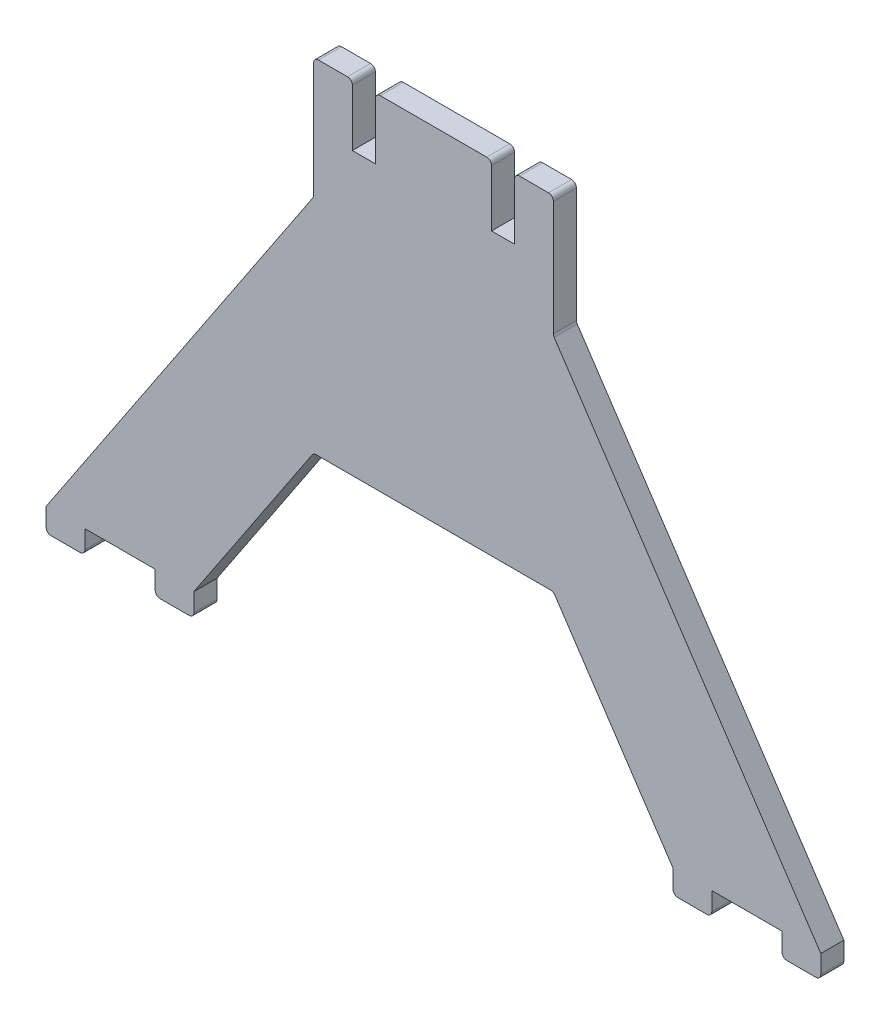
from build123d import *

# Parameters (mm, degrees)
BOSS_EXTRUDE1_DEPTH = 4.7625


with BuildPart() as part:
    # Sketch2 → Boss-Extrude1 (new body)
    with BuildSketch(Plane.XY):
        with BuildLine():
            Line((-23, -45.048102255), (-1, -45.048102255))
            ThreePointArc((-1, -45.048102255), (-0.292893219, -45.340995473), (0, -46.048102255))
            Line((0, -46.048102255), (0, -57.748102255))
            Line((0, -57.748102255), (4.7625, -57.748102255))
            Line((4.7625, -57.748102255), (4.7625, -46.048102255))
            ThreePointArc((4.7625, -46.048102255), (5.055393219, -45.340995473), (5.7625, -45.048102255))
            Line((5.7625, -45.048102255), (11.7625, -45.048102255))
            ThreePointArc((11.7625, -45.048102255), (12.469606781, -45.340995473), (12.7625, -46.048102255))
            Line((12.7625, -46.048102255), (12.7625, -69.765561421))
            ThreePointArc((12.7625, -69.765561421), (12.805346982, -70.055144052), (12.9302162, -70.319911199))
            Line((12.9302162, -70.319911199), (68, -153))
            Line((68, -153), (68, -156.7625))
            ThreePointArc((68, -156.7625), (67.707106781, -157.469606781), (67, -157.7625))
            Line((67, -157.7625), (61, -157.7625))
            ThreePointArc((61, -157.7625), (60.292893219, -157.469606781), (60, -156.7625))
            Line((60, -156.7625), (60, -153))
            Line((60, -153), (45.481563848, -153))
            Line((45.481563848, -153), (45.481563848, -156.7625))
            ThreePointArc((45.481563848, -156.7625), (45.188670629, -157.469606781), (44.481563848, -157.7625))
            Line((44.481563848, -157.7625), (38.481563848, -157.7625))
            ThreePointArc((38.481563848, -157.7625), (37.774457067, -157.469606781), (37.481563848, -156.7625))
            Line((37.481563848, -156.7625), (37.481563848, -153))
            Line((37.481563848, -153), (13.059329161, -116.333203921))
            ThreePointArc((13.059329161, -116.333203921), (12.699088908, -116.005978468), (12.227045361, -115.8875537))
            Line((12.227045361, -115.8875537), (-36.227045361, -115.8875537))
            ThreePointArc((-36.227045361, -115.8875537), (-36.699088908, -116.005978468), (-37.059329161, -116.333203921))
            Line((-37.059329161, -116.333203921), (-61.481563848, -153))
            Line((-61.481563848, -153), (-61.481563848, -156.7625))
            ThreePointArc((-61.481563848, -156.7625), (-61.774457067, -157.469606781), (-62.481563848, -157.7625))
            Line((-62.481563848, -157.7625), (-68.481563848, -157.7625))
            ThreePointArc((-68.481563848, -157.7625), (-69.188670629, -157.469606781), (-69.481563848, -156.7625))
            Line((-69.481563848, -156.7625), (-69.481563848, -153))
            Line((-69.481563848, -153), (-84, -153))
            Line((-84, -153), (-84, -156.7625))
            ThreePointArc((-84, -156.7625), (-84.292893219, -157.469606781), (-85, -157.7625))
            Line((-85, -157.7625), (-91, -157.7625))
            ThreePointArc((-91, -157.7625), (-91.707106781, -157.469606781), (-92, -156.7625))
            Line((-92, -156.7625), (-92, -153))
            Line((-92, -153), (-36.9302162, -70.319911199))
            ThreePointArc((-36.9302162, -70.319911199), (-36.805346982, -70.055144052), (-36.7625, -69.765561421))
            Line((-36.7625, -69.765561421), (-36.7625, -46.048102255))
            ThreePointArc((-36.7625, -46.048102255), (-36.469606781, -45.340995473), (-35.7625, -45.048102255))
            Line((-35.7625, -45.048102255), (-29.7625, -45.048102255))
            ThreePointArc((-29.7625, -45.048102255), (-29.055393219, -45.340995473), (-28.7625, -46.048102255))
            Line((-28.7625, -46.048102255), (-28.7625, -57.748102255))
            Line((-28.7625, -57.748102255), (-24, -57.748102255))
            Line((-24, -57.748102255), (-24, -46.048102255))
            ThreePointArc((-24, -46.048102255), (-23.707106781, -45.340995473), (-23, -45.048102255))
        make_face()
    extrude(amount=BOSS_EXTRUDE1_DEPTH)


solid = part.part
